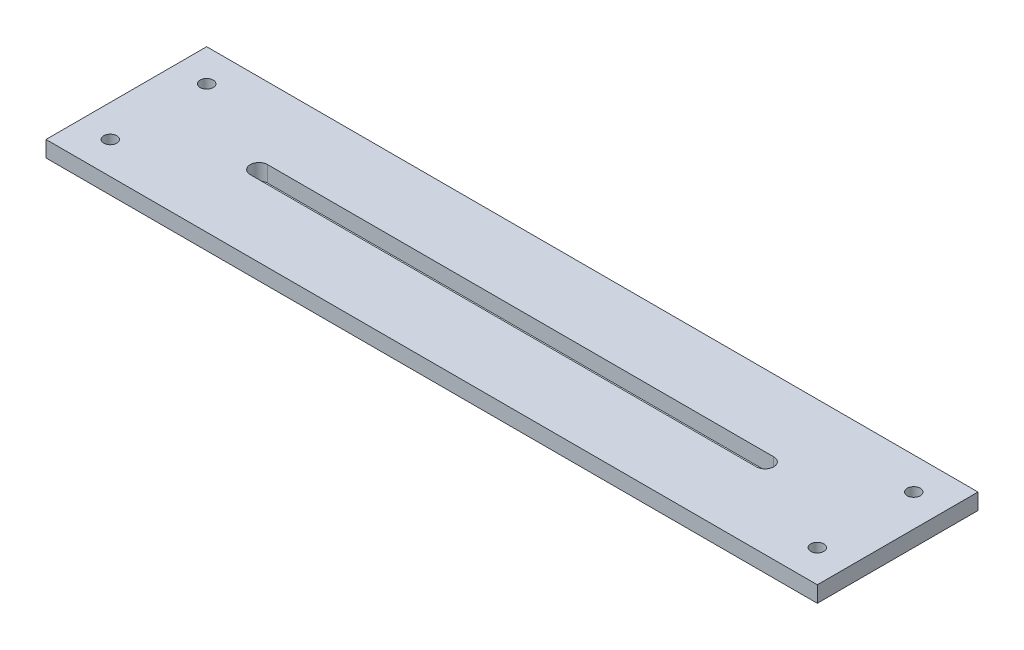
from build123d import *

# Parameters (mm, degrees)
SKETCH1_W           = 304.8
SKETCH1_H           = 63.5
SKETCH1_R           = 2.5796875
BOSS_EXTRUDE1_DEPTH = 6.35


with BuildPart() as part:
    # Sketch1 → Boss-Extrude1 (new body)
    with BuildSketch(Plane(origin=(0, 0, 0), x_dir=(1, 0, 0), z_dir=(0, 1, 0))):
        Rectangle(SKETCH1_W, SKETCH1_H)
        with Locations(Location((-139.7, 19.05, 0), (0, 0, 270))):
            Circle(SKETCH1_R, mode=Mode.SUBTRACT)
        with Locations(Location((139.7, 19.05, 0), (0, 0, 90))):
            Circle(SKETCH1_R, mode=Mode.SUBTRACT)
        with Locations(Location((139.7, -19.05, 0), (0, 0, 270))):
            Circle(SKETCH1_R, mode=Mode.SUBTRACT)
        with Locations(Location((-139.7, -19.05, 0), (0, 0, 90))):
            Circle(SKETCH1_R, mode=Mode.SUBTRACT)
        with BuildLine():
            Line((-100, 3.429), (100, 3.429))
            ThreePointArc((100, 3.429), (103.429, 0), (100, -3.429))
            Line((100, -3.429), (-100, -3.429))
            ThreePointArc((-100, -3.429), (-103.429, 0), (-100, 3.429))
        make_face(mode=Mode.SUBTRACT)
    extrude(amount=BOSS_EXTRUDE1_DEPTH)


solid = part.part
